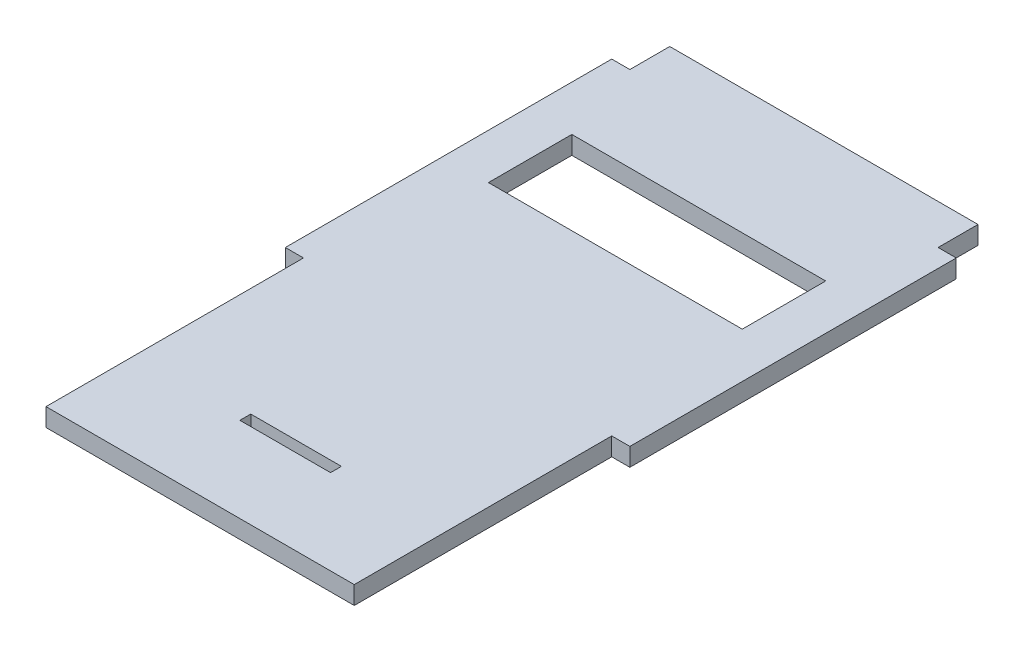
from build123d import *

# Parameters (mm, degrees)
CROQUIS1_W              = 25
CROQUIS1_H              = 3
CROQUIS1_W_2            = 70
CROQUIS1_H_2            = 23
SALIENTE_EXTRUIR1_DEPTH = 5


with BuildPart() as part:
    # Croquis1 → Saliente-Extruir1 (new body)
    with BuildSketch(Plane(origin=(0, 0, 0), x_dir=(1, 0, 0), z_dir=(0, 1, 0))):
        Polygon((-42.5, -86), (42.5, -86), (42.5, -15), (47.5, -15), (47.5, 75), (42.5, 75), (42.5, 86), (-42.5, 86), (-42.5, 75), (-47.5, 75), (-47.5, -15), (-42.5, -15), align=None)
        with Locations((0, -61.039633263)):
            Rectangle(CROQUIS1_W, CROQUIS1_H, mode=Mode.SUBTRACT)
        with Locations((0, 40)):
            Rectangle(CROQUIS1_W_2, CROQUIS1_H_2, mode=Mode.SUBTRACT)
    extrude(amount=SALIENTE_EXTRUIR1_DEPTH)


solid = part.part
